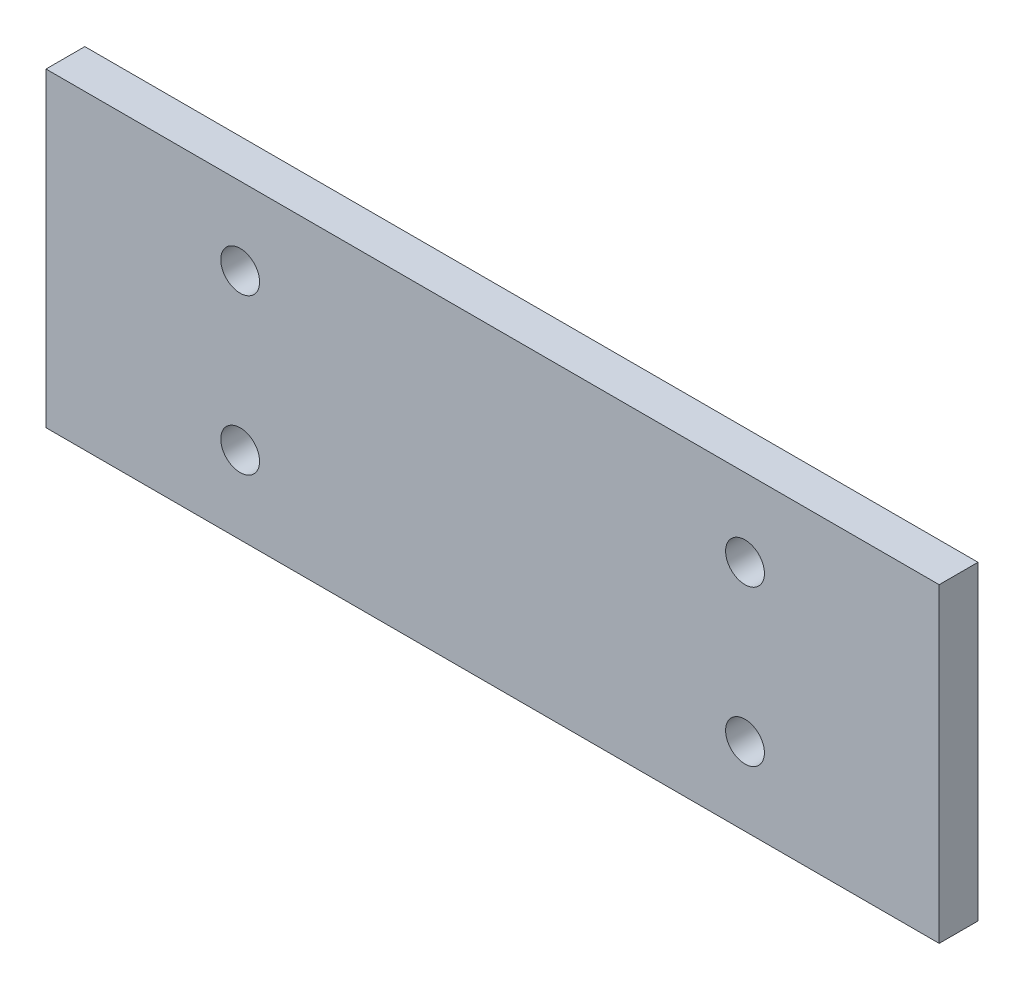
from build123d import *

# Parameters (mm, degrees)
SKETCH1_W           = 115
SKETCH1_H           = 40
SKETCH1_R           = 2.5
BOSS_EXTRUDE1_DEPTH = 5


with BuildPart() as part:
    # Sketch1 → Boss-Extrude1 (new body)
    with BuildSketch(Plane.XY):
        with Locations((0, 20)):
            Rectangle(SKETCH1_W, SKETCH1_H)
        with Locations((-32.5, 30)):
            Circle(SKETCH1_R, mode=Mode.SUBTRACT)
        with Locations((-32.5, 10)):
            Circle(SKETCH1_R, mode=Mode.SUBTRACT)
        with Locations((32.5, 10)):
            Circle(SKETCH1_R, mode=Mode.SUBTRACT)
        with Locations((32.5, 30)):
            Circle(SKETCH1_R, mode=Mode.SUBTRACT)
    extrude(amount=BOSS_EXTRUDE1_DEPTH)


solid = part.part
